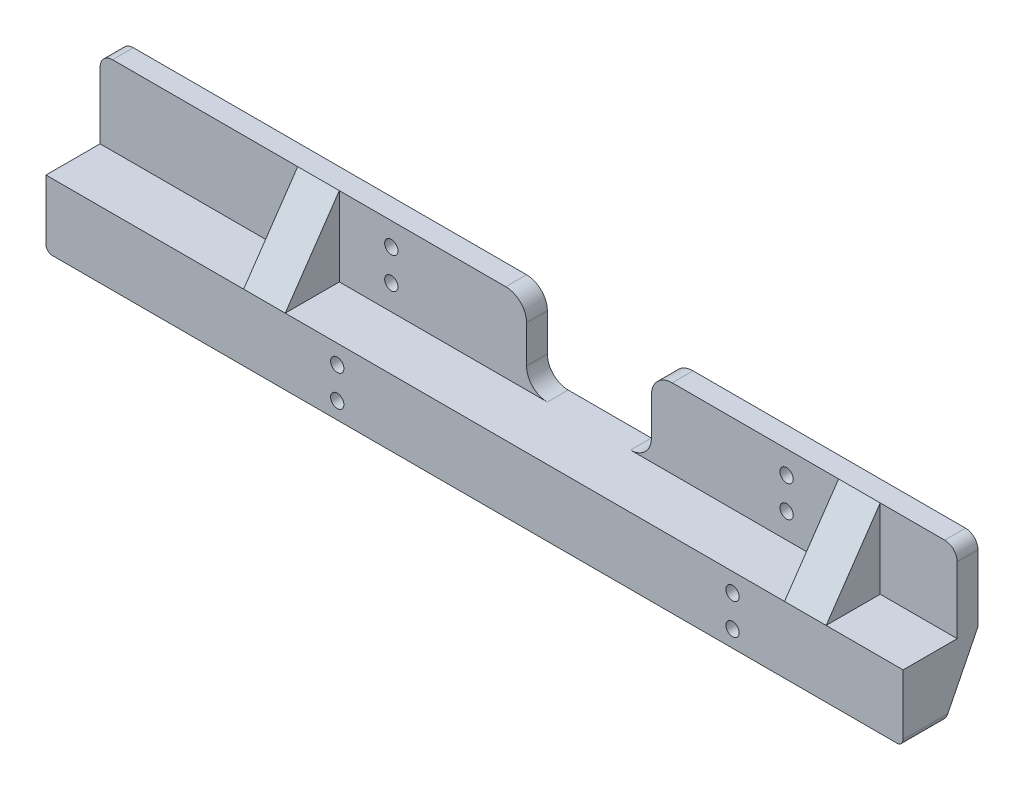
from build123d import *

# Parameters (mm, degrees)
SKETCH_1_W           = 235
SKETCH_1_H           = 35
SKETCH_1_R           = 1.6
EXTRUDE_1_DEPTH      = 18
FILLET_1_R           = 1.5
CUT_EXTRUDE_1_DEPTH  = 237.337153237
SKETCH_3_W           = 13
SKETCH_3_H           = 19
CUT_EXTRUDE_2_DEPTH  = 237.337153237
SKETCH_5_R           = 1.6
CUT_EXTRUDE_5_DEPTH  = 121.151987083
SKETCH_6_R           = 3
CUT_EXTRUDE_6_DEPTH  = 10
SKETCH_10_W          = 29
SKETCH_10_H          = 35
CUT_EXTRUDE_9_DEPTH  = 30
FILLET_2_R           = 3
FILLET_5_R           = 1.5
SKETCH_11_W          = 30
SKETCH_11_H          = 19
CUT_EXTRUDE_10_DEPTH = 30
FILLET_6_R           = 5
EXTRUDE_2_DEPTH      = 10
SKETCH_13_W          = 250
SKETCH_13_H          = 88
CUT_EXTRUDE_11_DEPTH = 168.142155066


with BuildPart() as part:
    # 草图1 → 凸台-拉伸1 (new body)
    with BuildSketch(Plane.XY):
        Rectangle(SKETCH_1_W, SKETCH_1_H)
        with Locations((-47.5, 13.5)):
            Circle(SKETCH_1_R, mode=Mode.SUBTRACT)
        with Locations(Location((47.5, 13.5, 0), (0, 0, 180))):
            Circle(SKETCH_1_R, mode=Mode.SUBTRACT)
        with Locations((-47.5, 6)):
            Circle(SKETCH_1_R, mode=Mode.SUBTRACT)
        with Locations(Location((47.5, 6, 0), (0, 0, 180))):
            Circle(SKETCH_1_R, mode=Mode.SUBTRACT)
    extrude(amount=EXTRUDE_1_DEPTH)

    # 圆角1
    fillet_1_edges = [part.edges().sort_by_distance(p)[0] for p in [
        (-117.5, 17.5, 9),
        (117.5, 17.5, 9),
    ]]
    fillet(fillet_1_edges, radius=FILLET_1_R)

    # 草图2 → 切除-拉伸1 (cut, through all)
    with BuildSketch(Plane.ZY.offset(117.5)):
        Polygon((0, 1.5), (8, 17.5), (0, 17.5), align=None)
    extrude(amount=-CUT_EXTRUDE_1_DEPTH, mode=Mode.SUBTRACT)

    # 草图3 → 切除-拉伸2 (cut, through all)
    with BuildSketch(Plane.ZY.offset(117.5)):
        with Locations((11.5, -8)):
            Rectangle(SKETCH_3_W, SKETCH_3_H)
    extrude(amount=-CUT_EXTRUDE_2_DEPTH, mode=Mode.SUBTRACT)

    # 草图5 → 切除-拉伸5 (cut, through all)
    with BuildSketch(Plane(origin=(0, 0, 0), x_dir=(-1, 0, 0), z_dir=(0, 0, -1))):
        with Locations((47.5, -4.5)):
            Circle(SKETCH_5_R)
        with Locations((47.5, -12)):
            Circle(SKETCH_5_R)
        with Locations(Location((-47.5, -12, 0), (0, 0, 90))):
            Circle(SKETCH_5_R)
        with Locations(Location((-47.5, -4.5, 0), (0, 0, 90))):
            Circle(SKETCH_5_R)
    extrude(amount=-CUT_EXTRUDE_5_DEPTH, mode=Mode.SUBTRACT)

    # 草图6 → 切除-拉伸6 (cut)
    with BuildSketch(Plane(origin=(0, 0, 0), x_dir=(-1, 0, 0), z_dir=(0, 0, -1))):
        with Locations((47.5, 6)):
            Circle(SKETCH_6_R)
        with Locations((47.5, 13.5)):
            Circle(SKETCH_6_R)
        with Locations((-47.5, 6)):
            Circle(SKETCH_6_R)
        with Locations((-47.5, 13.5)):
            Circle(SKETCH_6_R)
    extrude(amount=-CUT_EXTRUDE_6_DEPTH, mode=Mode.SUBTRACT)

    # 草图10 → 切除-拉伸9 (cut)
    with BuildSketch(Plane(origin=(0, 0, 0), x_dir=(-1, 0, 0), z_dir=(0, 0, -1))):
        with Locations((-103, 0)):
            Rectangle(SKETCH_10_W, SKETCH_10_H)
    extrude(amount=-CUT_EXTRUDE_9_DEPTH, mode=Mode.SUBTRACT)

    # 圆角2
    fillet_2_edges = [part.edges().sort_by_distance(p)[0] for p in [
        (88.5, -17.5, 2.5),
        (-117.5, -17.5, 2.5),
    ]]
    fillet(fillet_2_edges, radius=FILLET_2_R)

    # 圆角5
    fillet_5_edges = [part.edges().sort_by_distance(p)[0] for p in [
        (88.5, 17.5, 13),
    ]]
    fillet(fillet_5_edges, radius=FILLET_5_R)

    # 草图11 → 切除-拉伸10 (cut)
    with BuildSketch(Plane(origin=(0, 0, 0), x_dir=(-1, 0, 0), z_dir=(0, 0, -1))):
        with Locations((0, -8)):
            Rectangle(SKETCH_11_W, SKETCH_11_H)
    extrude(amount=-CUT_EXTRUDE_10_DEPTH, mode=Mode.SUBTRACT)

    # 圆角6
    fillet_6_edges = [part.edges().sort_by_distance(p)[0] for p in [
        (15, 1.5, 2.5),
        (-15, -17.5, 2.5),
        (15, -17.5, 2.5),
        (-15, 1.5, 2.5),
    ]]
    fillet(fillet_6_edges, radius=FILLET_6_R)

    # 草图12 → 凸台-拉伸2 (add)
    with BuildSketch(Plane(origin=(60, 0, 0), x_dir=(0, 0, -1), z_dir=(1, 0, 0))):
        Polygon((-18, 1.5), (-5, -17.5), (-5, 1.5), align=None)
    extrude_2 = extrude(amount=EXTRUDE_2_DEPTH)

    # 镜向1: 凸台-拉伸2 across plane
    add(extrude_2.mirror(Plane(origin=(0, 0, 0), x_dir=(0, 0, 1), z_dir=(1, 0, 0))))


with BuildPart() as body_2:
    # 镜向2: mirrored copy
    add(part.part.mirror(Plane.ZX.offset(-50)))


with BuildPart() as part_1:
    add(part.part)

    # 草图13 → 切除-拉伸11 (cut, through all)
    with BuildSketch(Plane(origin=(0, 0, 0), x_dir=(-1, 0, 0), z_dir=(0, 0, -1))):
        with Locations((13.680717654, 5.907187604)):
            Rectangle(SKETCH_13_W, SKETCH_13_H)
    extrude(amount=-CUT_EXTRUDE_11_DEPTH, mode=Mode.SUBTRACT)


solid = body_2.part
